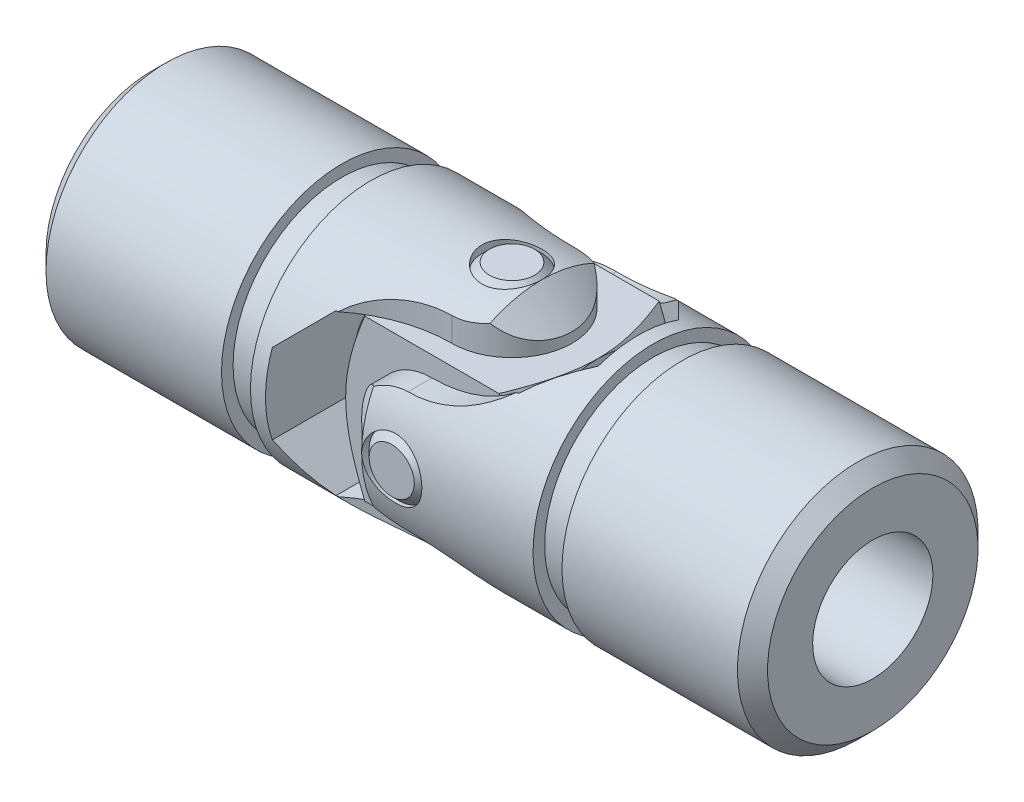
from build123d import *

# Parameters (mm, degrees)
CHAMFER1_SIZE               = 1.984375
CHAMFER2_SIZE               = 3.96875
EXTRUDE1_DEPTH              = 53.651418547
EXTRUDE1_DEPTH_BACK         = 53.651418547
EXTRUDE3_DEPTH              = 53.651418607
EXTRUDE3_DEPTH_BACK         = 53.651418607
SKETCH4_R                   = 7.9375
EXTRUDE4_DEPTH              = 26.9875
EXTRUDE6_DEPTH              = 53.651418607
EXTRUDE6_DEPTH_BACK         = 53.651418607
SKETCH6_R                   = 3.96875
BODY_MOVE_COPY1_ANGLE       = 90
EXTRUDE10_REACH             = 54.651
SKETCH10_W                  = 22.76475
SKETCH10_H                  = 21.1455
EXTRUDE10_DIRECTION_2_REACH = 54.651
SKETCH11_OUTSIDE_W          = 276.978
SKETCH11_OUTSIDE_H          = 276.978
SKETCH11_OUTSIDE_R          = 10.57275
EXTRUDE11_DEPTH             = 64.13399687
EXTRUDE11_DRAFT             = -60
SKETCH12_OUTSIDE_W          = 305.541
SKETCH12_OUTSIDE_H          = 305.54
SKETCH12_OUTSIDE_R          = 10.57275
EXTRUDE12_DEPTH             = 72.379382753
EXTRUDE12_DRAFT             = 60
EXTRUDE13_DEPTH             = 53.651418607
EXTRUDE13_DEPTH_BACK        = 53.651418607
SKETCH13_R                  = 3.96875
SKETCH14_R                  = 3.96875
EXTRUDE14_DEPTH             = 15.875
EXTRUDE15_DEPTH             = 53.651418607
EXTRUDE15_DEPTH_BACK        = 53.651418607
SKETCH15_R                  = 3.96875
SKETCH16_R                  = 3.96875
EXTRUDE16_DEPTH             = 15.875
CHAMFER3_SIZE               = 0.9921875


with BuildPart() as part:
    # Sketch1 → Revolve1 (revolve)
    with BuildSketch(Plane(origin=(0, 0, 0), x_dir=(1, 0, 0), z_dir=(0, 1, 0)), mode=Mode.PRIVATE) as revolve1_sk:
        Polygon((-47.625, 15.875), (-22.473046875, 15.875), (-22.473046875, 14.34703125), (-18.653125, 14.34703125), (-18.653125, 15.875), (7.9375, 15.875), (7.9375, 0), (-47.625, 0), align=None)
    revolve(revolve1_sk.sketch.rotate(Axis((-47.625, 0, 0), (1, 0, 0)), 180), axis=Axis((-47.625, 0, 0), (1, 0, 0)))

    # Chamfer1
    chamfer1_edges = [part.edges().sort_by_distance(p)[0] for p in [
        (-47.625, 0, -15.875),
    ]]
    chamfer(chamfer1_edges, length=CHAMFER1_SIZE)

    # Chamfer2
    chamfer2_edges = [part.edges().sort_by_distance(p)[0] for p in [
        (7.9375, 0, -15.875),
    ]]
    chamfer(chamfer2_edges, length=CHAMFER2_SIZE)

    # Sketch2 → Extrude1 (cut, two sides: drawn at the far end of the back side and taken through both)
    with BuildSketch(Plane(origin=(0, 0, 0), x_dir=(1, 0, 0), z_dir=(0, 1, 0)).offset(-EXTRUDE1_DEPTH_BACK)):
        with BuildLine():
            Line((-14.833203125, 15.875), (15.875, 15.875))
            Line((15.875, 15.875), (15.875, -15.875))
            Line((15.875, -15.875), (-14.833203125, -15.875))
            ThreePointArc((-14.833203125, -15.875), (-8.41171536, -10.046631091), (0, -7.9375))
            ThreePointArc((0, -7.9375), (7.9375, 0), (0, 7.9375))
            ThreePointArc((0, 7.9375), (-8.41171536, 10.046631091), (-14.833203125, 15.875))
        make_face()
    extrude(amount=EXTRUDE1_DEPTH + EXTRUDE1_DEPTH_BACK, mode=Mode.SUBTRACT)

    # Sketch3 → Extrude3 (cut, two sides: drawn at the far end of the back side and taken through both)
    with BuildSketch(Plane.XY.offset(-EXTRUDE3_DEPTH_BACK)):
        Polygon((-11.382375, 10.57275), (-16.66875, 5.286375), (-16.66875, -5.286375), (-11.382375, -10.57275), (15.875, -10.57275), (15.875, 10.57275), align=None)
    extrude(amount=EXTRUDE3_DEPTH + EXTRUDE3_DEPTH_BACK, mode=Mode.SUBTRACT)

    # Sketch4 → Extrude4 (cut)
    with BuildSketch(Plane.ZY.offset(47.625)):
        Circle(SKETCH4_R)
    extrude(amount=-EXTRUDE4_DEPTH, mode=Mode.SUBTRACT)

    # Extrude5 cone 1 section (through the dimple's axis) → Extrude5 (revolve, cut)
    with BuildSketch(Plane(origin=(-20.6375, 0, 0), x_dir=(0, 0, 1), z_dir=(0, 1, 0))):
        Polygon((0, 0), (7.9375, 0), (0, 7.9375), align=None)
    revolve(axis=Axis((-20.6375, 0, 0), (1, 0, 0)), mode=Mode.SUBTRACT)

    # Sketch6 → Extrude6 (cut, two sides: drawn at the far end of the back side and taken through both)
    with BuildSketch(Plane(origin=(0, 0, 0), x_dir=(1, 0, 0), z_dir=(0, 1, 0)).offset(-EXTRUDE6_DEPTH_BACK)):
        with Locations(Location((0, 0, 0), (0, 0, 180))):
            Circle(SKETCH6_R)
    extrude(amount=EXTRUDE6_DEPTH + EXTRUDE6_DEPTH_BACK, mode=Mode.SUBTRACT)


with BuildPart() as body_2:
    # Mirror1: mirrored copy
    add(part.part.mirror(Plane(origin=(0, 0, 0), x_dir=(0, 0, 1), z_dir=(1, 0, 0))))


with BuildPart() as body_2_1:
    # Body-Move/Copy1: moved
    add(body_2.part.rotate(Axis((0, 0, 0), (1, 0, 0)), BODY_MOVE_COPY1_ANGLE))


with BuildPart() as body_3:

    # Extrude10: up to this face of the body (flat: up to its plane)
    extrude10_end = Plane(body_2_1.part.faces().sort_by_distance((11.076730124, 0, -10.57275))[0])
    # Sketch10 → Extrude10 (new, up to the picked face)
    with BuildSketch(Plane.XY, mode=Mode.PRIVATE) as extrude10_sk1:
        Rectangle(SKETCH10_W, SKETCH10_H)
    extrude10_tool1 = split(extrude(extrude10_sk1.sketch, amount=-EXTRUDE10_REACH, mode=Mode.PRIVATE), bisect_by=extrude10_end, keep=Keep.BOTH, mode=Mode.PRIVATE)
    add(extrude10_tool1.solids().sort_by(Axis((0, 0, 0), (0, 0, -1)))[0])


    # Extrude10 direction 2: up to this face of the body (flat: up to its plane)
    extrude10_direction_2_end = Plane(body_2_1.part.faces().sort_by_distance((11.258443926, -11.536339014, 10.57275))[0])
    # Sketch10 → Extrude10 direction 2 (add, up to the picked face)
    with BuildSketch(Plane.XY, mode=Mode.PRIVATE) as extrude10_direction_2_sk1:
        Rectangle(SKETCH10_W, SKETCH10_H)
    extrude10_direction_2_tool1 = split(extrude(extrude10_direction_2_sk1.sketch, amount=EXTRUDE10_DIRECTION_2_REACH, mode=Mode.PRIVATE), bisect_by=extrude10_direction_2_end, keep=Keep.BOTH, mode=Mode.PRIVATE)
    add(extrude10_direction_2_tool1.solids().sort_by(Axis((0, 0, 0), (0, 0, 1)))[0])


with BuildPart() as extrude11_tool:
    # Sketch11 outside → Extrude11 (with draft: the straight prism first)
    with BuildSketch(Plane(origin=(11.382375, 0, 0), x_dir=(0, 0, -1), z_dir=(1, 0, 0))):
        Rectangle(SKETCH11_OUTSIDE_W, SKETCH11_OUTSIDE_H)
        Circle(SKETCH11_OUTSIDE_R, mode=Mode.SUBTRACT)
    extrude(amount=-EXTRUDE11_DEPTH)
    # Extrude11: the draft: its side faces are tilted about the plane it starts from
    extrude11_sides = [extrude11_tool.faces().sort_by_distance(p)[0] for p in [
        (-20.684623435, -138.489, 0),
        (-20.684623435, 0, -138.489),
        (-20.684623435, 138.489, 0),
        (-20.684623435, 0, 138.489),
        (-20.684623435, 0, 10.57275),
    ]]
    draft(extrude11_sides, Plane(origin=(11.382375, 0, 0), x_dir=(0, 0, -1), z_dir=(1, 0, 0)), EXTRUDE11_DRAFT)


with BuildPart() as body_3_1:
    add(body_3.part)

    # Extrude11: cut by extrude11_tool
    add(extrude11_tool.part, mode=Mode.SUBTRACT)


with BuildPart() as extrude12_tool:
    # Sketch12 outside → Extrude12 (with draft: the straight prism first)
    with BuildSketch(Plane(origin=(-11.382375, -21.0185, 0), x_dir=(0, -1, 0), z_dir=(1, 0, 0))):
        with Locations((-21.0185, 0)):
            Rectangle(SKETCH12_OUTSIDE_W, SKETCH12_OUTSIDE_H)
        with Locations((-21.0185, 0)):
            Circle(SKETCH12_OUTSIDE_R, mode=Mode.SUBTRACT)
    extrude(amount=EXTRUDE12_DEPTH)
    # Extrude12: the draft: its side faces are tilted about the plane it starts from
    extrude12_sides = [extrude12_tool.faces().sort_by_distance(p)[0] for p in [
        (24.807316376, 0, 152.77),
        (24.807316376, -152.7705, 0),
        (24.807316376, 0, -152.77),
        (24.807316376, 152.7705, 0),
        (24.807316376, 10.57275, 0),
    ]]
    draft(extrude12_sides, Plane(origin=(-11.382375, -21.0185, 0), x_dir=(0, -1, 0), z_dir=(1, 0, 0)), EXTRUDE12_DRAFT)


with BuildPart() as body_3_2:
    add(body_3_1.part)

    # Extrude12: cut by extrude12_tool
    add(extrude12_tool.part, mode=Mode.SUBTRACT)

    # Sketch13 → Extrude13 (cut, two sides: drawn at the far end of the back side and taken through both)
    with BuildSketch(Plane(origin=(0, 0, 0), x_dir=(1, 0, 0), z_dir=(0, 1, 0)).offset(-EXTRUDE13_DEPTH_BACK)):
        with Locations(Location((0, 0, 0), (0, 0, 270))):
            Circle(SKETCH13_R)
    extrude(amount=EXTRUDE13_DEPTH + EXTRUDE13_DEPTH_BACK, mode=Mode.SUBTRACT)

    # Sketch15 → Extrude15 (cut, two sides: drawn at the far end of the back side and taken through both)
    with BuildSketch(Plane.XY.offset(-EXTRUDE15_DEPTH_BACK)):
        Circle(SKETCH15_R)
    extrude(amount=EXTRUDE15_DEPTH + EXTRUDE15_DEPTH_BACK, mode=Mode.SUBTRACT)


with BuildPart() as body_4:
    # Sketch14 → Extrude14 (new, symmetric)
    with BuildSketch(Plane(origin=(0, 0, 0), x_dir=(1, 0, 0), z_dir=(0, 1, 0))):
        with Locations(Location((0, 0, 0), (0, 0, 270))):
            Circle(SKETCH14_R)
    extrude(amount=EXTRUDE14_DEPTH, both=True)

    # Sketch16 → Extrude16 (add, symmetric)
    with BuildSketch(Plane.XY):
        Circle(SKETCH16_R)
    extrude(amount=EXTRUDE16_DEPTH, both=True)

    # Chamfer3
    chamfer3_edges = [body_4.edges().sort_by_distance(p)[0] for p in [
        (0, -15.875, -3.96875),
        (0, 15.875, -3.96875),
        (-3.96875, 0, -15.875),
        (-3.96875, 0, 15.875),
    ]]
    chamfer(chamfer3_edges, length=CHAMFER3_SIZE)


solid = Compound([part.part, body_2_1.part, body_3_2.part, body_4.part])
